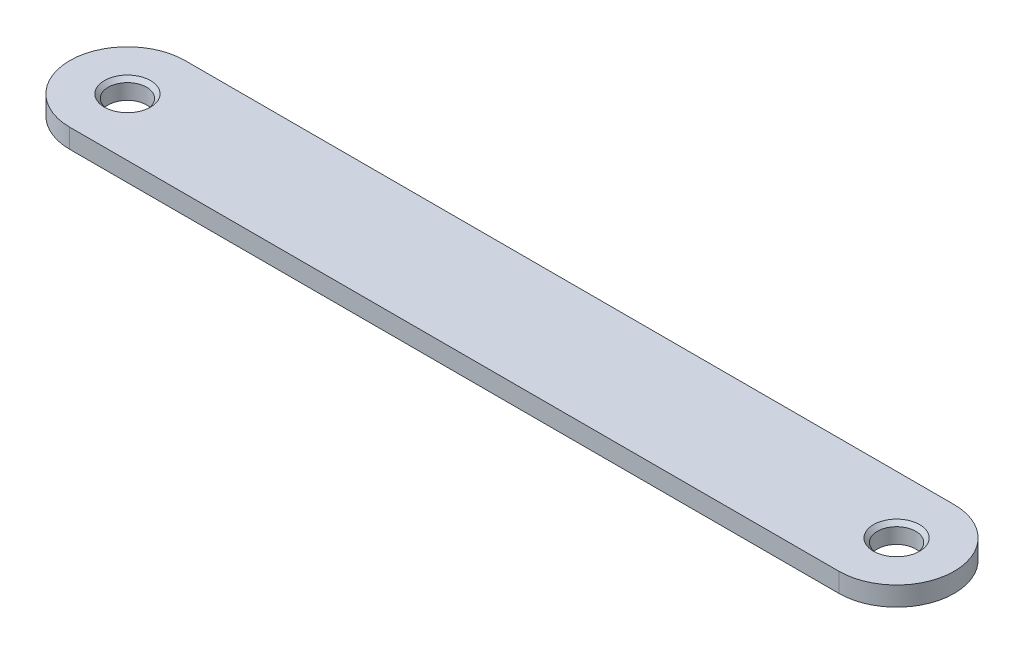
from build123d import *

# Parameters (mm, degrees)
SKETCH1_R           = 5
BOSS_EXTRUDE1_DEPTH = 5
CHAMFER1_SIZE       = 1
CHAMFER2_SIZE       = 1


with BuildPart() as part:
    # Sketch1 → Boss-Extrude1 (new body)
    with BuildSketch(Plane(origin=(0, 0, 0), x_dir=(1, 0, 0), z_dir=(0, 1, 0))):
        with BuildLine():
            Line((0, 15), (200, 15))
            ThreePointArc((200, 15), (215, 0), (200, -15))
            Line((200, -15), (0, -15))
            ThreePointArc((0, -15), (-15, 0), (0, 15))
        make_face()
        with Locations(Location((0, 0, 0), (0, 0, 270))):
            Circle(SKETCH1_R, mode=Mode.SUBTRACT)
        with Locations(Location((200, 0, 0), (0, 0, 270))):
            Circle(SKETCH1_R, mode=Mode.SUBTRACT)
    extrude(amount=BOSS_EXTRUDE1_DEPTH)

    # Chamfer1
    chamfer1_edges = [part.edges().sort_by_distance(p)[0] for p in [
        (200, 5, -5),
    ]]
    chamfer(chamfer1_edges, length=CHAMFER1_SIZE)

    # Chamfer2
    chamfer2_edges = [part.edges().sort_by_distance(p)[0] for p in [
        (0, 5, -5),
    ]]
    chamfer(chamfer2_edges, length=CHAMFER2_SIZE)


solid = part.part
